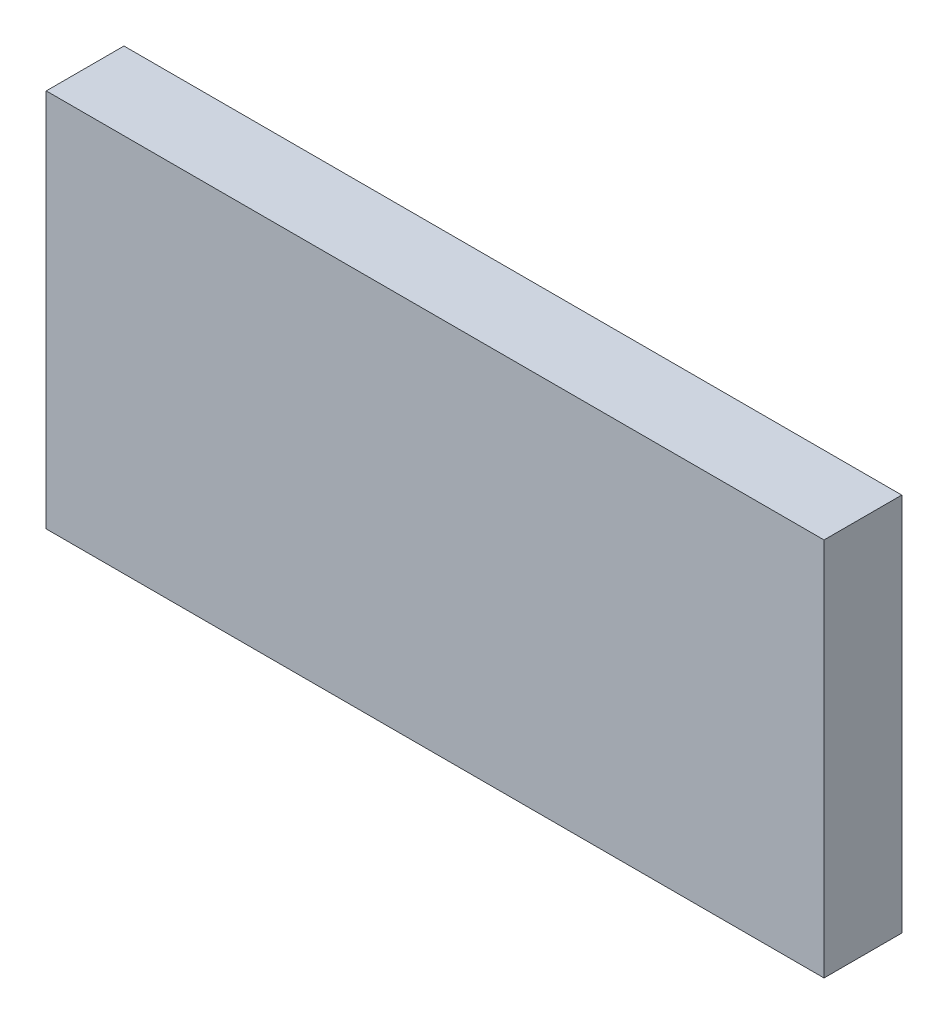
from build123d import *

# Parameters (mm, degrees)
SKETCH1_W               = 10.005
SKETCH1_H               = 4.88
COMPONENT_OUTLINE_DEPTH = 1


with BuildPart() as part:
    # Sketch1 → Component_Outline (new body)
    with BuildSketch(Plane.XY):
        with Locations((-0.0025, -0.565)):
            Rectangle(SKETCH1_W, SKETCH1_H)
    extrude(amount=COMPONENT_OUTLINE_DEPTH)


solid = part.part
